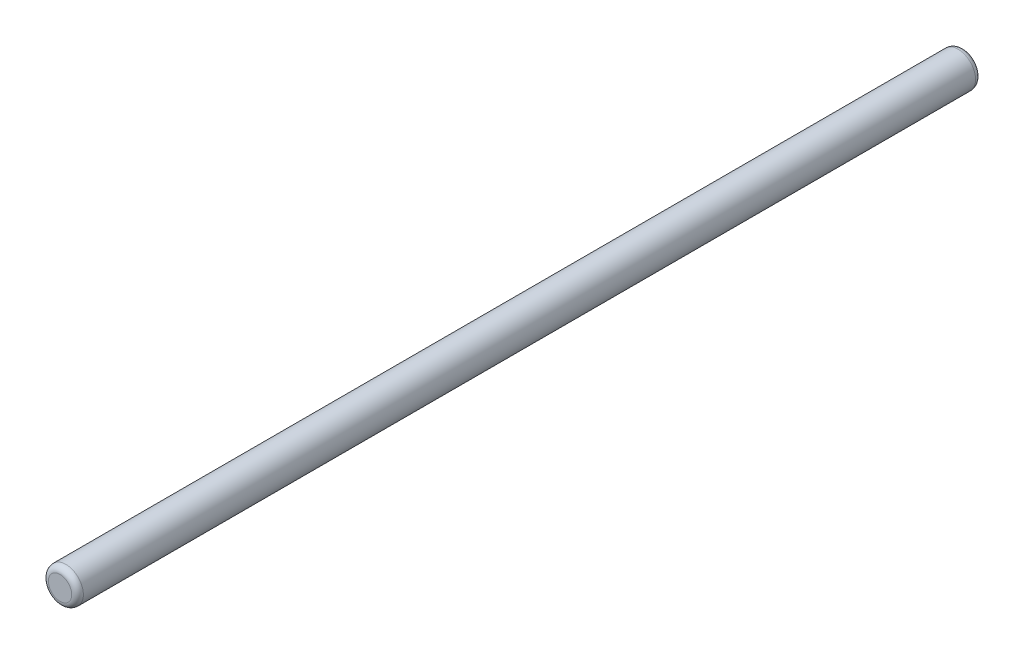
from build123d import *

# Parameters (mm, degrees)
SKIZZE1_R     = 3
BOLZEN_DEPTH  = 155
VERRUNDUNG1_R = 1


with BuildPart() as part:
    # Skizze1 → Bolzen (new body)
    with BuildSketch(Plane.XY):
        Circle(SKIZZE1_R)
    extrude(amount=BOLZEN_DEPTH)

    # Verrundung1
    verrundung1_edges = [part.edges().sort_by_distance(p)[0] for p in [
        (-3, 0, 0),
        (-3, 0, 155),
    ]]
    fillet(verrundung1_edges, radius=VERRUNDUNG1_R)


solid = part.part
